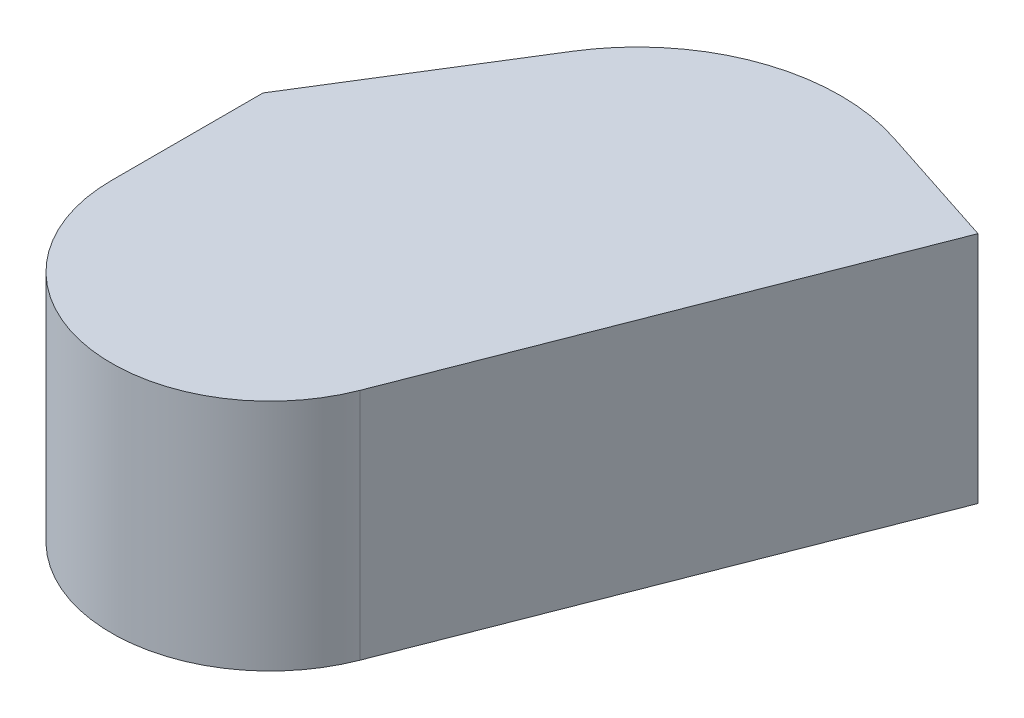
from build123d import *

# Parameters (mm, degrees)
BOSS_EXTRUDE1_DEPTH = 58.42
FILLET3_R           = 39.603164


with BuildPart() as part:
    # Sketch1 → Boss-Extrude1 (new body)
    with BuildSketch(Plane(origin=(0, 0, 0), x_dir=(1, 0, 0), z_dir=(0, 1, 0))):
        with BuildLine():
            Line((-66.673768512, 0), (-37.067821873, 47.633329988))
            ThreePointArc((-37.067821873, 47.633329988), (-11.329209284, 68.541566023), (21.82652777, 69.113940477))
            Line((21.82652777, 69.113940477), (53.138492197, 58.903517294))
            Line((53.138492197, 58.903517294), (0, -77.45185891))
            Line((0, -77.45185891), (-66.673768512, -77.45185891))
            Line((-66.673768512, -77.45185891), (-66.673768512, 0))
        make_face()
    extrude(amount=BOSS_EXTRUDE1_DEPTH)

    # Fillet3
    fillet3_edges = [part.edges().sort_by_distance(p)[0] for p in [
        (0, 29.21, 77.45185891),
        (-66.673768512, 29.21, 77.45185891),
    ]]
    fillet(fillet3_edges, radius=FILLET3_R)


solid = part.part
